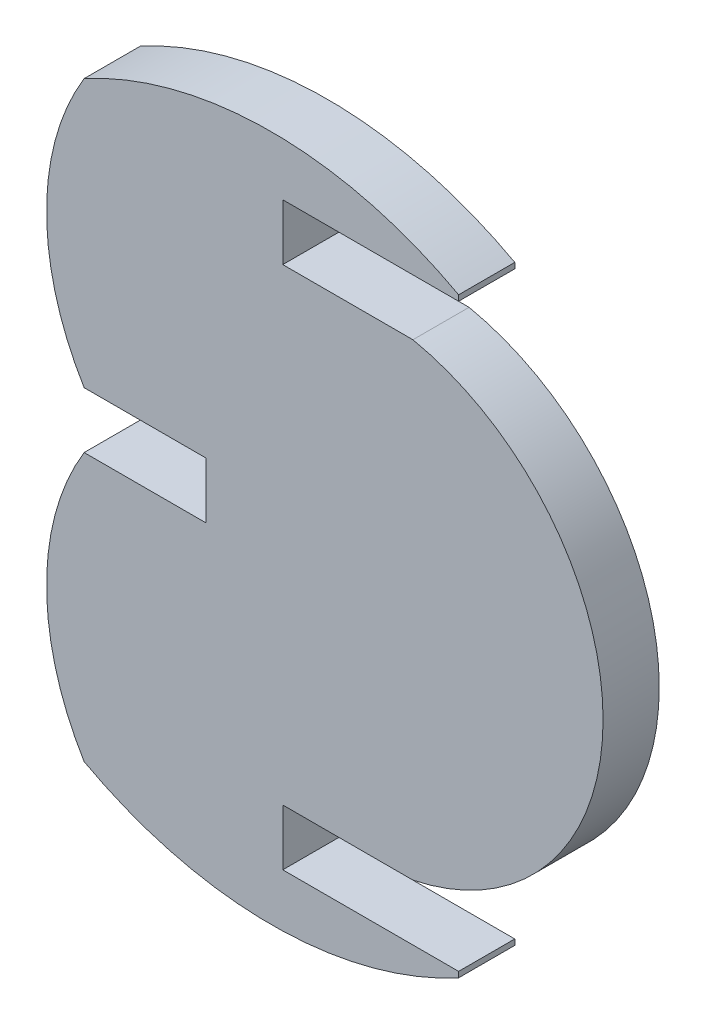
from build123d import *

# Parameters (mm, degrees)
BASE_EXTRUDE_DEPTH = 3


with BuildPart() as part:
    # Sketch1 → Base-Extrude (new body)
    with BuildSketch(Plane.XY):
        with BuildLine():
            Line((-1361.676742431, 33.692843094), (-1355.157111394, 33.692843094))
            Line((-1355.157111394, 33.692843094), (-1355.157111394, 36.692843094))
            Line((-1355.157111394, 36.692843094), (-1361.676742431, 36.692843094))
            ThreePointArc((-1361.676742431, 36.692843094), (-1363.682913665, 43.843214905), (-1361.676742431, 50.993586716))
            ThreePointArc((-1361.676742431, 50.993586716), (-1351.674443371, 53.537029915), (-1341.672144311, 50.993586716))
            Line((-1341.672144311, 50.993586716), (-1341.672144311, 50.692843094))
            Line((-1341.672144311, 50.692843094), (-1351.065792881, 50.692843094))
            Line((-1351.065792881, 50.692843094), (-1351.065792881, 47.692843094))
            Line((-1351.065792881, 47.692843094), (-1344.113445951, 47.692843094))
            ThreePointArc((-1344.113445951, 47.692843094), (-1333.95450385, 35.192843094), (-1344.113445951, 22.692843094))
            Line((-1344.113445951, 22.692843094), (-1351.065792881, 22.692843094))
            Line((-1351.065792881, 22.692843094), (-1351.065792881, 19.692843094))
            Line((-1351.065792881, 19.692843094), (-1341.672144311, 19.692843094))
            Line((-1341.672144311, 19.692843094), (-1341.672144311, 19.392099471))
            ThreePointArc((-1341.672144311, 19.392099471), (-1351.674443371, 16.848656272), (-1361.676742431, 19.392099471))
            ThreePointArc((-1361.676742431, 19.392099471), (-1363.682913665, 26.542471282), (-1361.676742431, 33.692843094))
        make_face()
    extrude(amount=BASE_EXTRUDE_DEPTH)


solid = part.part
